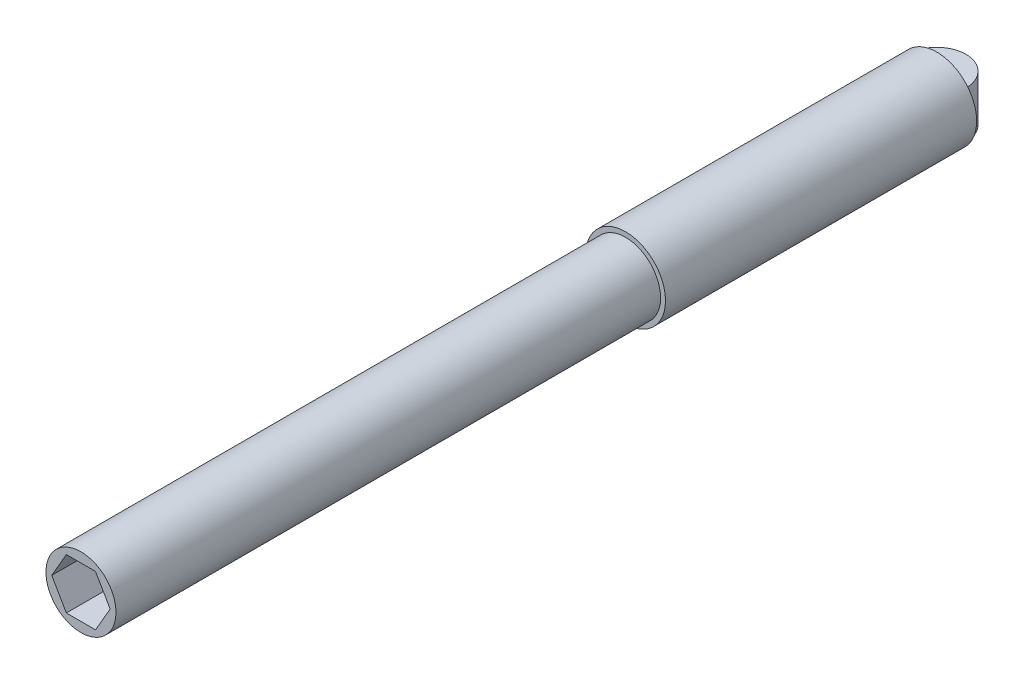
from build123d import *

# Parameters (mm, degrees)
SKETCH1_R                = 1.025
BOSS_EXTRUDE1_DEPTH      = 12
CUT_EXTRUDE1_DEPTH       = 7
BOSS_EXTRUDE2_START      = 4
SKETCH3_R                = 1.025
BOSS_EXTRUDE2_DEPTH      = 4
SKETCH6_R                = 1.025
BOSS_EXTRUDE5_DEPTH      = 7
BOSS_EXTRUDE6_START      = 2
SKETCH7_R                = 1.025
BOSS_EXTRUDE6_DEPTH      = 2
BOSS_EXTRUDE8_DEPTH      = 0.6
BOSS_EXTRUDE8_DEPTH_BACK = 0.6
CUT_EXTRUDE3_START       = -17
SKETCH9_R                = 1.025
CUT_EXTRUDE3_DEPTH       = 17
SKETCH10_R               = 0.9
BOSS_EXTRUDE12_DEPTH     = 14


with BuildPart() as part:
    # Sketch1 → Boss-Extrude1 (new body)
    with BuildSketch(Plane.XY):
        Circle(SKETCH1_R)
    extrude(amount=BOSS_EXTRUDE1_DEPTH)

    # Sketch2 → Cut-Extrude1 (cut)
    with BuildSketch(Plane.XY.offset(12)):
        Polygon((0.866025404, 0), (0.433012702, 0.75), (-0.433012702, 0.75), (-0.866025404, 0), (-0.433012702, -0.75), (0.433012702, -0.75), align=None)
    extrude(amount=-CUT_EXTRUDE1_DEPTH, mode=Mode.SUBTRACT)

    # Sketch3 → Boss-Extrude2 (add)
    with BuildSketch(Plane(origin=(0, 0, 0), x_dir=(-1, 0, 0), z_dir=(0, 0, -1)).offset(BOSS_EXTRUDE2_START)):
        Circle(SKETCH3_R)
    extrude(amount=-BOSS_EXTRUDE2_DEPTH)

    # Sketch6 → Boss-Extrude5 (add)
    with BuildSketch(Plane.XY.offset(12)):
        with Locations(Location((0, 0, 0), (0, 0, 180))):
            Circle(SKETCH6_R)
        Polygon((0.866025404, 0), (0.433012702, 0.75), (-0.433012702, 0.75), (-0.866025404, 0), (-0.433012702, -0.75), (0.433012702, -0.75), align=None, mode=Mode.SUBTRACT)
    extrude(amount=BOSS_EXTRUDE5_DEPTH)

    # Sketch7 → Boss-Extrude6 (add)
    with BuildSketch(Plane(origin=(0, 0, -4), x_dir=(-1, 0, 0), z_dir=(0, 0, -1)).offset(BOSS_EXTRUDE6_START)):
        Circle(SKETCH7_R)
    extrude(amount=-BOSS_EXTRUDE6_DEPTH)

    # Sketch8 → Boss-Extrude8 (add, two sides: drawn at the far end of the back side and taken through both)
    with BuildSketch(Plane(origin=(0, 0, 0), x_dir=(1, 0, 0), z_dir=(0, 1, 0)).offset(-BOSS_EXTRUDE8_DEPTH_BACK)):
        with BuildLine():
            ThreePointArc((0.75, 6), (0, 6.75), (-0.75, 6))
            Line((-0.75, 6), (0.75, 6))
        make_face()
        with BuildLine():
            Line((0.75, 6), (-0.75, 6))
            ThreePointArc((-0.75, 6), (0, 5.25), (0.75, 6))
        make_face()
    extrude(amount=BOSS_EXTRUDE8_DEPTH + BOSS_EXTRUDE8_DEPTH_BACK)

    # Sketch9 → Cut-Extrude3 (cut)
    with BuildSketch(Plane.XY.offset(19).offset(CUT_EXTRUDE3_START)):
        with Locations(Location((0, 0, 0), (0, 0, 180))):
            Circle(SKETCH9_R)
    extrude(amount=CUT_EXTRUDE3_DEPTH, mode=Mode.SUBTRACT)

    # Sketch10 → Boss-Extrude12 (add)
    with BuildSketch(Plane.XY.offset(2)):
        Circle(SKETCH10_R)
        Polygon((0.75055535, 0), (0.375277675, 0.65), (-0.375277675, 0.65), (-0.75055535, 0), (-0.375277675, -0.65), (0.375277675, -0.65), align=None, mode=Mode.SUBTRACT)
    extrude(amount=BOSS_EXTRUDE12_DEPTH)


solid = part.part
